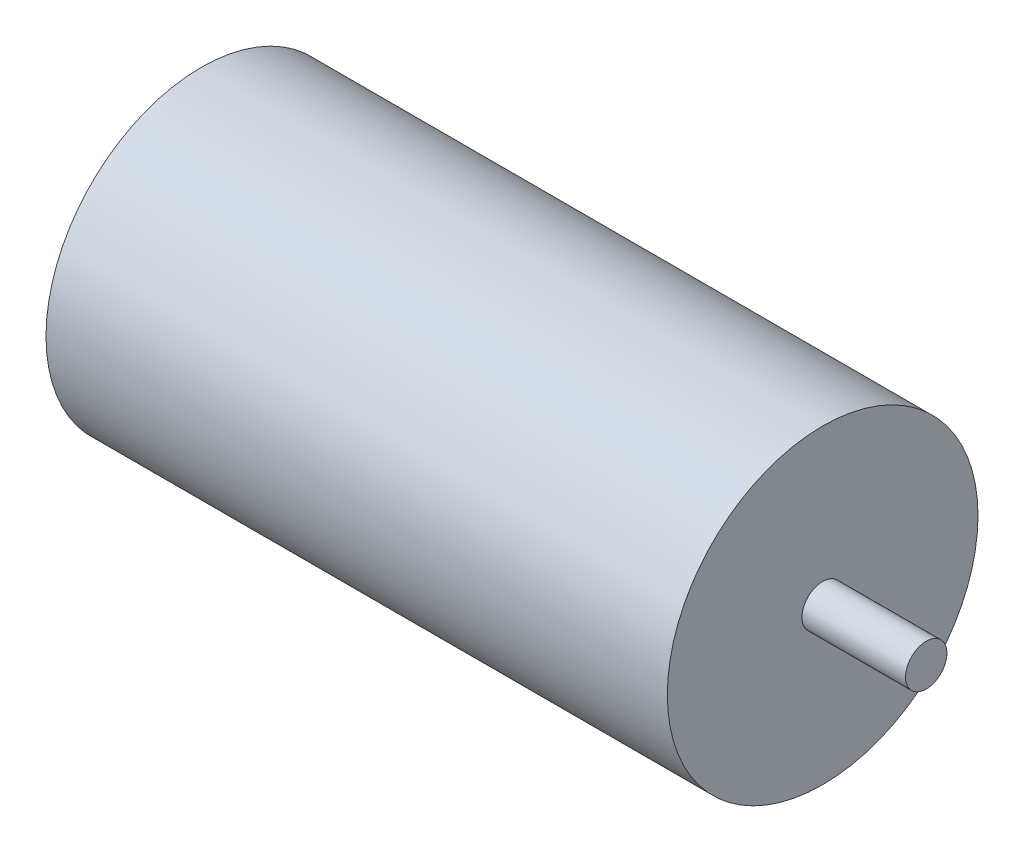
from build123d import *

# Parameters (mm, degrees)
SKETCH1_R           = 30
BOSS_EXTRUDE1_DEPTH = 120
SKETCH2_R           = 4
BOSS_EXTRUDE2_DEPTH = 20


with BuildPart() as part:
    # Sketch1 → Boss-Extrude1 (new body)
    with BuildSketch(Plane(origin=(0, 0, 0), x_dir=(0, 0, -1), z_dir=(1, 0, 0))):
        Circle(SKETCH1_R)
    extrude(amount=BOSS_EXTRUDE1_DEPTH)

    # Sketch2 → Boss-Extrude2 (add)
    with BuildSketch(Plane(origin=(120, 0, 0), x_dir=(0, 0, -1), z_dir=(1, 0, 0))):
        Circle(SKETCH2_R)
    extrude(amount=BOSS_EXTRUDE2_DEPTH)


solid = part.part
